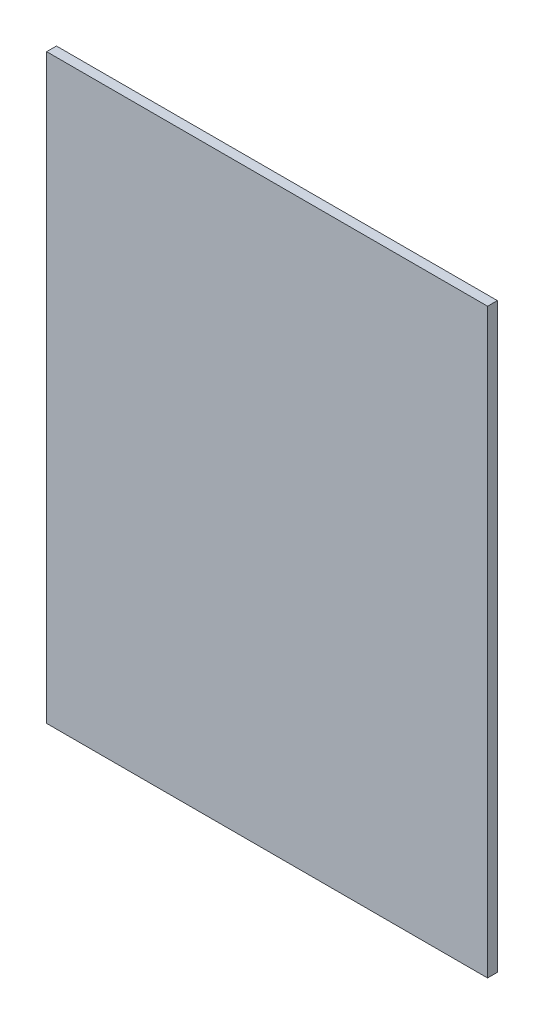
from build123d import *

# Parameters (mm, degrees)
SKETCH_1_W      = 72
SKETCH_1_H      = 95
EXTRUDE_1_DEPTH = 1.6


with BuildPart() as part:
    # ｽｹｯﾁ1 → ﾎﾞｽ - 押し出し1 (new body)
    with BuildSketch(Plane.XY):
        with Locations((-37.894417438, 14.492857143)):
            Rectangle(SKETCH_1_W, SKETCH_1_H)
    extrude(amount=EXTRUDE_1_DEPTH)


solid = part.part
